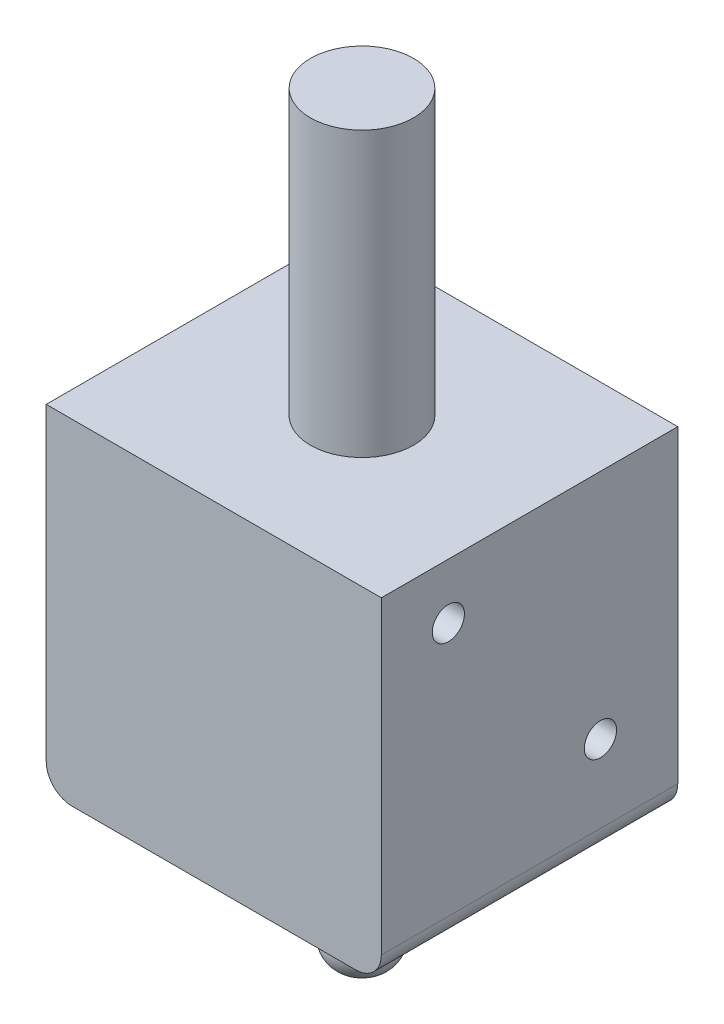
from build123d import *

# Parameters (mm, degrees)
SKETCH1_W             = 26
SKETCH1_H             = 23
BOSS_EXTRUDE1_DEPTH   = 26
M3_TAPPED_HOLE1_D     = 2.5
M3_TAPPED_HOLE1_DEPTH = 10.1
M3_TAPPED_HOLE1_TIP   = 0.751075774
FILLET1_R             = 2
SKETCH5_R             = 4
BOSS_EXTRUDE2_DEPTH   = 22
SKETCH6_R             = 2.5
BOSS_EXTRUDE3_DEPTH   = 11
FILLET2_R             = 2


with BuildPart() as part:
    # Sketch1 → Boss-Extrude1 (new body)
    with BuildSketch(Plane(origin=(0, 0, 0), x_dir=(1, 0, 0), z_dir=(0, 1, 0))):
        Rectangle(SKETCH1_W, SKETCH1_H)
    extrude(amount=BOSS_EXTRUDE1_DEPTH)

    # M3 Tapped Hole1
    with Locations(Plane(origin=(13, 0, 0), x_dir=(0, 0, -1), z_dir=(1, 0, 0))):
        with Locations((-6.3, 21.7), (5.5, 8)):
            Hole(M3_TAPPED_HOLE1_D / 2, depth=M3_TAPPED_HOLE1_DEPTH)
            with Locations((0, 0, -(M3_TAPPED_HOLE1_DEPTH + M3_TAPPED_HOLE1_TIP / 2))):  # 118° drill point
                Cone(0, M3_TAPPED_HOLE1_D / 2, M3_TAPPED_HOLE1_TIP, mode=Mode.SUBTRACT)

    # Fillet1
    fillet1_edges = [part.edges().sort_by_distance(p)[0] for p in [
        (-13, 0, 0),
        (13, 0, 0),
    ]]
    fillet(fillet1_edges, radius=FILLET1_R)

    # Sketch5 → Boss-Extrude2 (add)
    with BuildSketch(Plane(origin=(0, 26, 0), x_dir=(1, 0, 0), z_dir=(0, 1, 0))):
        with Locations(Location((0, 0, 0), (0, 0, 270))):
            Circle(SKETCH5_R)
    extrude(amount=BOSS_EXTRUDE2_DEPTH)

    # Sketch6 → Boss-Extrude3 (add)
    with BuildSketch(Plane.XZ):
        with Locations(Location((0, 0, 0), (0, 0, 270))):
            Circle(SKETCH6_R)
    extrude(amount=BOSS_EXTRUDE3_DEPTH)

    # Fillet2
    fillet2_edges = [part.edges().sort_by_distance(p)[0] for p in [
        (0, -11, 2.5),
    ]]
    fillet(fillet2_edges, radius=FILLET2_R)


solid = part.part
